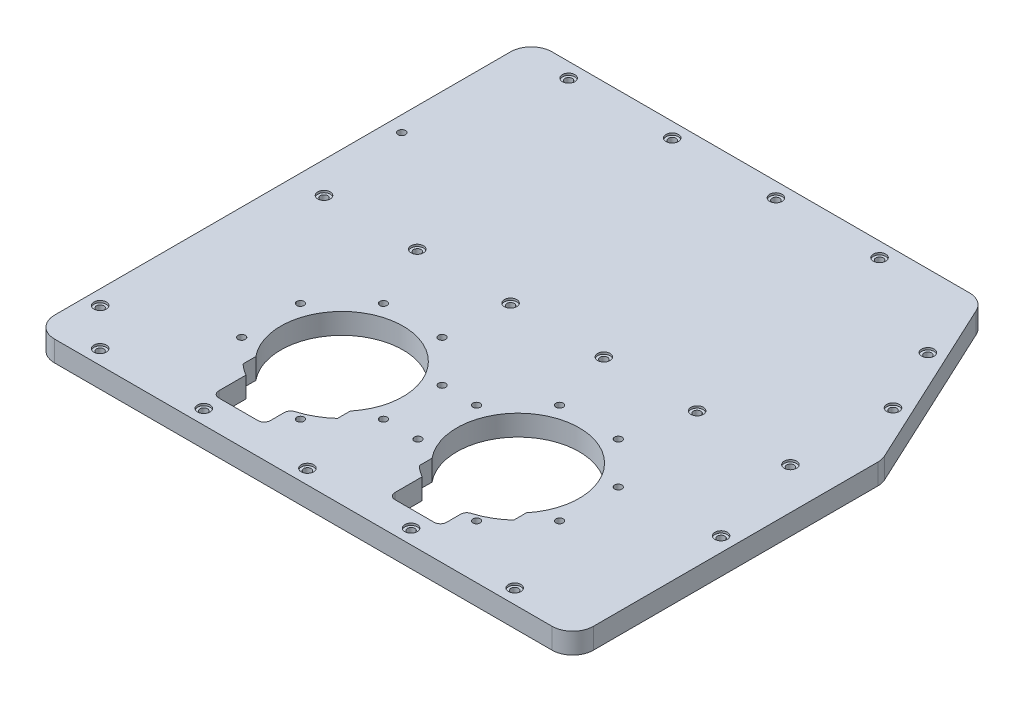
from build123d import *

# Parameters (mm, degrees)
EXTRUDE_1_DEPTH     = 10
SKETCH_2_R          = 1.75
CUT_EXTRUDE_1_DEPTH = 354.977400409
SKETCH_3_R          = 1.8
CUT_EXTRUDE_2_DEPTH = 354.977400409
CUT_EXTRUDE_3_REACH = 355.977
SKETCH_4_R          = 1.8
SKETCH_5_R          = 3
CUT_EXTRUDE_4_DEPTH = 1
SKETCH_8_R          = 4.907977916
SKETCH_8_R_2        = 2.263946164
EXTRUDE_3_DEPTH     = 2
CUT_EXTRUDE_5_REACH = 356.04
SKETCH_9_R          = 1.8
SKETCH_10_R         = 3
CUT_EXTRUDE_6_DEPTH = 1


with BuildPart() as part:
    # 草图1 → 凸台-拉伸1 (new body)
    with BuildSketch(Plane(origin=(0, 0, 0), x_dir=(1, 0, 0), z_dir=(0, 1, 0))):
        with BuildLine():
            Line((10, 0), (250, 0))
            ThreePointArc((250, 0), (257.071067812, 2.928932188), (260, 10))
            Line((260, 10), (260, 147.15227467))
            ThreePointArc((260, 147.15227467), (259.762960071, 149.316670809), (259.06307787, 151.378457287))
            Line((259.06307787, 151.378457287), (220.430549088, 234.226182617))
            ThreePointArc((220.430549088, 234.226182617), (216.740467301, 238.433914458), (211.367471218, 240))
            Line((211.367471218, 240), (10, 240))
            ThreePointArc((10, 240), (2.928932188, 237.071067812), (0, 230))
            Line((0, 230), (0, 10))
            ThreePointArc((0, 10), (2.928932188, 2.928932188), (10, 0))
        make_face()
    extrude(amount=EXTRUDE_1_DEPTH)

    # 草图2 → 切除-拉伸1 (cut, through all)
    with BuildSketch(Plane(origin=(0, 10, 0), x_dir=(1, 0, 0), z_dir=(0, 1, 0))):
        with BuildLine():
            ThreePointArc((98.278969632, 27.656873897), (96.730761312, 26.574772268), (96.136112489, 24.781929354))
            Line((96.136112489, 24.781929354), (96.136112489, 18))
            ThreePointArc((96.136112489, 18), (95.257432832, 15.878679656), (93.136112489, 15))
            Line((93.136112489, 15), (88.636112489, 15))
            Line((88.636112489, 15), (74.226112489, 15))
            ThreePointArc((74.226112489, 15), (72.104792145, 15.878679656), (71.226112489, 18))
            Line((71.226112489, 18), (71.226112489, 31.087123976))
            ThreePointArc((71.226112489, 31.087123976), (68.439256555, 32.960223552), (65.852320225, 35.100977729))
            Line((65.852320225, 35.100977729), (65.852320225, 41.261034979))
            ThreePointArc((65.852320225, 41.261034979), (88.636112489, 89.5), (111.419904753, 41.261034979))
            Line((111.419904753, 41.261034979), (111.419904753, 35.100977729))
            ThreePointArc((111.419904753, 35.100977729), (105.271182925, 30.634426081), (98.278969632, 27.656873897))
        make_face()
        with Locations(Location((74.476825491, 94.183542703, 0), (0, 0, 270))):
            Circle(SKETCH_2_R)
        with Locations(Location((102.795399486, 94.183542703, 0), (0, 0, 270))):
            Circle(SKETCH_2_R)
        with Locations(Location((122.819655192, 45.840713002, 0), (0, 0, 270))):
            Circle(SKETCH_2_R)
        with Locations(Location((102.795399486, 25.816457297, 0), (0, 0, 270))):
            Circle(SKETCH_2_R)
        with Locations(Location((54.452569786, 45.840713002, 0), (0, 0, 270))):
            Circle(SKETCH_2_R)
        with Locations(Location((54.452569786, 74.159286998, 0), (0, 0, 270))):
            Circle(SKETCH_2_R)
        with BuildLine():
            ThreePointArc((183.278969632, 27.656873897), (181.730761312, 26.574772268), (181.136112489, 24.781929354))
            Line((181.136112489, 24.781929354), (181.136112489, 18))
            ThreePointArc((181.136112489, 18), (180.257432832, 15.878679656), (178.136112489, 15))
            Line((178.136112489, 15), (173.636112489, 15))
            Line((173.636112489, 15), (159.226112489, 15))
            ThreePointArc((159.226112489, 15), (157.104792145, 15.878679656), (156.226112489, 18))
            Line((156.226112489, 18), (156.226112489, 31.087123976))
            ThreePointArc((156.226112489, 31.087123976), (153.439256555, 32.960223552), (150.852320225, 35.100977729))
            Line((150.852320225, 35.100977729), (150.852320225, 41.261034979))
            ThreePointArc((150.852320225, 41.261034979), (173.636112489, 89.5), (196.419904753, 41.261034979))
            Line((196.419904753, 41.261034979), (196.419904753, 35.100977729))
            ThreePointArc((196.419904753, 35.100977729), (190.271182925, 30.634426081), (183.278969632, 27.656873897))
        make_face()
        with Locations(Location((207.819655192, 45.840713002, 0), (0, 0, 270))):
            Circle(SKETCH_2_R)
        with Locations(Location((187.795399486, 25.816457297, 0), (0, 0, 270))):
            Circle(SKETCH_2_R)
        with Locations(Location((122.819655192, 74.159286998, 0), (0, 0, 270))):
            Circle(SKETCH_2_R)
        with Locations(Location((139.452569786, 45.840713002, 0), (0, 0, 270))):
            Circle(SKETCH_2_R)
        with Locations(Location((139.452569786, 74.159286998, 0), (0, 0, 270))):
            Circle(SKETCH_2_R)
        with Locations(Location((159.476825491, 94.183542703, 0), (0, 0, 270))):
            Circle(SKETCH_2_R)
        with Locations(Location((187.795399486, 94.183542703, 0), (0, 0, 270))):
            Circle(SKETCH_2_R)
        with Locations(Location((207.819655192, 74.159286998, 0), (0, 0, 270))):
            Circle(SKETCH_2_R)
    extrude(amount=-CUT_EXTRUDE_1_DEPTH, mode=Mode.SUBTRACT)

    # 草图3 → 切除-拉伸2 (cut, through all)
    with BuildSketch(Plane(origin=(0, 10, 0), x_dir=(1, 0, 0), z_dir=(0, 1, 0))):
        with Locations(Location((25, 7, 0), (0, 0, 270))):
            Circle(SKETCH_3_R)
        with Locations(Location((75, 7, 0), (0, 0, 270))):
            Circle(SKETCH_3_R)
        with Locations(Location((125, 7, 0), (0, 0, 270))):
            Circle(SKETCH_3_R)
        with Locations(Location((175, 7, 0), (0, 0, 270))):
            Circle(SKETCH_3_R)
        with Locations(Location((225, 7, 0), (0, 0, 270))):
            Circle(SKETCH_3_R)
        with Locations(Location((25, 233, 0), (0, 0, 270))):
            Circle(SKETCH_3_R)
        with Locations(Location((75, 233, 0), (0, 0, 270))):
            Circle(SKETCH_3_R)
        with Locations(Location((125, 233, 0), (0, 0, 270))):
            Circle(SKETCH_3_R)
        with Locations(Location((175, 233, 0), (0, 0, 270))):
            Circle(SKETCH_3_R)
        with Locations(Location((253, 78.576137335, 0), (0, 0, 270))):
            Circle(SKETCH_3_R)
        with Locations(Location((7, 25, 0), (0, 0, 270))):
            Circle(SKETCH_3_R)
        with Locations(Location((226.335296429, 205, 0), (0, 0, 270))):
            Circle(SKETCH_3_R)
        with Locations(Location((241.038259994, 173.469392883, 0), (0, 0, 270))):
            Circle(SKETCH_3_R)
    extrude(amount=-CUT_EXTRUDE_2_DEPTH, mode=Mode.SUBTRACT)

    # 草图4 → 切除-拉伸3 (cut, up to next)
    with BuildSketch(Plane(origin=(0, 10, 0), x_dir=(1, 0, 0), z_dir=(0, 1, 0)), mode=Mode.PRIVATE) as cut_extrude_3_sk1:
        with Locations(Location((15, 125, 0), (0, 0, 270))):
            Circle(SKETCH_4_R)
    cut_extrude_3_tool1 = extrude(cut_extrude_3_sk1.sketch, amount=-CUT_EXTRUDE_3_REACH, mode=Mode.PRIVATE) & part.part
    # 草图4 → 切除-拉伸3 (cut, up to next)
    with BuildSketch(Plane(origin=(0, 10, 0), x_dir=(1, 0, 0), z_dir=(0, 1, 0)), mode=Mode.PRIVATE) as cut_extrude_3_sk2:
        with Locations(Location((60, 125, 0), (0, 0, 270))):
            Circle(SKETCH_4_R)
    cut_extrude_3_tool2 = extrude(cut_extrude_3_sk2.sketch, amount=-CUT_EXTRUDE_3_REACH, mode=Mode.PRIVATE) & part.part
    # 草图4 → 切除-拉伸3 (cut, up to next)
    with BuildSketch(Plane(origin=(0, 10, 0), x_dir=(1, 0, 0), z_dir=(0, 1, 0)), mode=Mode.PRIVATE) as cut_extrude_3_sk3:
        with Locations(Location((105, 125, 0), (0, 0, 270))):
            Circle(SKETCH_4_R)
    cut_extrude_3_tool3 = extrude(cut_extrude_3_sk3.sketch, amount=-CUT_EXTRUDE_3_REACH, mode=Mode.PRIVATE) & part.part
    # 草图4 → 切除-拉伸3 (cut, up to next)
    with BuildSketch(Plane(origin=(0, 10, 0), x_dir=(1, 0, 0), z_dir=(0, 1, 0)), mode=Mode.PRIVATE) as cut_extrude_3_sk4:
        with Locations(Location((150, 125, 0), (0, 0, 270))):
            Circle(SKETCH_4_R)
    cut_extrude_3_tool4 = extrude(cut_extrude_3_sk4.sketch, amount=-CUT_EXTRUDE_3_REACH, mode=Mode.PRIVATE) & part.part
    # 草图4 → 切除-拉伸3 (cut, up to next)
    with BuildSketch(Plane(origin=(0, 10, 0), x_dir=(1, 0, 0), z_dir=(0, 1, 0)), mode=Mode.PRIVATE) as cut_extrude_3_sk5:
        with Locations(Location((195, 125, 0), (0, 0, 270))):
            Circle(SKETCH_4_R)
    cut_extrude_3_tool5 = extrude(cut_extrude_3_sk5.sketch, amount=-CUT_EXTRUDE_3_REACH, mode=Mode.PRIVATE) & part.part
    # 草图4 → 切除-拉伸3 (cut, up to next)
    with BuildSketch(Plane(origin=(0, 10, 0), x_dir=(1, 0, 0), z_dir=(0, 1, 0)), mode=Mode.PRIVATE) as cut_extrude_3_sk6:
        with Locations(Location((240, 125, 0), (0, 0, 270))):
            Circle(SKETCH_4_R)
    cut_extrude_3_tool6 = extrude(cut_extrude_3_sk6.sketch, amount=-CUT_EXTRUDE_3_REACH, mode=Mode.PRIVATE) & part.part
    add(cut_extrude_3_tool1.solids().sort_by_distance((15, 10, -125))[0], mode=Mode.SUBTRACT)
    add(cut_extrude_3_tool2.solids().sort_by_distance((60, 10, -125))[0], mode=Mode.SUBTRACT)
    add(cut_extrude_3_tool3.solids().sort_by_distance((105, 10, -125))[0], mode=Mode.SUBTRACT)
    add(cut_extrude_3_tool4.solids().sort_by_distance((150, 10, -125))[0], mode=Mode.SUBTRACT)
    add(cut_extrude_3_tool5.solids().sort_by_distance((195, 10, -125))[0], mode=Mode.SUBTRACT)
    add(cut_extrude_3_tool6.solids().sort_by_distance((240, 10, -125))[0], mode=Mode.SUBTRACT)

    # 草图5 → 切除-拉伸4 (cut)
    with BuildSketch(Plane.XZ):
        with Locations(Location((25, -7, 0), (0, 0, 270))):
            Circle(SKETCH_5_R)
        with Locations(Location((75, -7, 0), (0, 0, 270))):
            Circle(SKETCH_5_R)
        with Locations(Location((125, -7, 0), (0, 0, 270))):
            Circle(SKETCH_5_R)
        with Locations(Location((175, -7, 0), (0, 0, 270))):
            Circle(SKETCH_5_R)
        with Locations(Location((225, -7, 0), (0, 0, 270))):
            Circle(SKETCH_5_R)
        with Locations(Location((15, -125, 0), (0, 0, 270))):
            Circle(SKETCH_5_R)
        with Locations(Location((60, -125, 0), (0, 0, 270))):
            Circle(SKETCH_5_R)
        with Locations(Location((150, -125, 0), (0, 0, 270))):
            Circle(SKETCH_5_R)
        with Locations(Location((105, -125, 0), (0, 0, 270))):
            Circle(SKETCH_5_R)
        with Locations(Location((240, -125, 0), (0, 0, 270))):
            Circle(SKETCH_5_R)
        with Locations(Location((195, -125, 0), (0, 0, 270))):
            Circle(SKETCH_5_R)
        with Locations(Location((25, -233, 0), (0, 0, 270))):
            Circle(SKETCH_5_R)
        with Locations(Location((75, -233, 0), (0, 0, 270))):
            Circle(SKETCH_5_R)
        with Locations(Location((125, -233, 0), (0, 0, 270))):
            Circle(SKETCH_5_R)
        with Locations(Location((175, -233, 0), (0, 0, 270))):
            Circle(SKETCH_5_R)
        with Locations(Location((226.335296429, -205, 0), (0, 0, 270))):
            Circle(SKETCH_5_R)
        with Locations(Location((241.038259994, -173.469392883, 0), (0, 0, 270))):
            Circle(SKETCH_5_R)
        with Locations(Location((253, -78.576137335, 0), (0, 0, 270))):
            Circle(SKETCH_5_R)
        with Locations(Location((7, -25, 0), (0, 0, 270))):
            Circle(SKETCH_5_R)
    cut_extrude_4 = extrude(amount=-CUT_EXTRUDE_4_DEPTH, mode=Mode.SUBTRACT)

    # 镜向1: 切除-拉伸4 across plane
    add(cut_extrude_4.mirror(Plane(origin=(0, 5, 0), x_dir=(0, 0, 1), z_dir=(0, -1, 0))), mode=Mode.SUBTRACT)

    # 草图8 → 凸台-拉伸3 (add)
    # profile 1 of 9: a face of its own
    with BuildSketch(Plane.XZ):
        with Locations(Location((158.544951124, -177.365322878, 0), (0, 0, 270))):
            Circle(SKETCH_8_R)
        with Locations(Location((158.544951124, -177.365322878, 0), (0, 0, 270))):
            Circle(SKETCH_8_R_2, mode=Mode.SUBTRACT)
    # profile 2 of 9: a face of its own
    with BuildSketch(Plane.XZ):
        with Locations(Location((173.660573493, -195.305752058, 0), (0, 0, 270))):
            Circle(SKETCH_8_R)
        with Locations(Location((173.660573493, -195.305752058, 0), (0, 0, 270))):
            Circle(SKETCH_8_R_2, mode=Mode.SUBTRACT)
    # profile 3 of 9: a face of its own
    with BuildSketch(Plane.XZ):
        Polygon((22.073938374, -172.097822024), (15.231344223, -200.682207265), (22.073938374, -200.682207265), (24.685267184, -189.773591751), (38.187143954, -189.773591751), (39.662170874, -183.611785747), (26.054433583, -183.611785747), (28.810672003, -172.097822024), align=None)
    # profile 4 of 9: a face of its own
    with BuildSketch(Plane.XZ):
        Polygon((44.809009261, -172.097822024), (38.187143954, -200.682207265), (44.809009261, -200.682207265), (51.430874568, -172.097822024), align=None)
    # profile 5 of 9: a face of its own
    with BuildSketch(Plane.XZ):
        with BuildLine():
            Line((53.748527425, -194.391435224), (48.119941914, -200.682207265))
            Line((48.119941914, -200.682207265), (71.627563754, -200.682207265))
            add(Edge.make_bspline(
                [(73.780158647, -183.246086784), (75.088103818, -183.395423758), (76.759745619, -184.457891186), (79.163494419, -186.207419575), (80.010768681, -188.654391183), (80.521360508, -191.374485794), (80.151623322, -194.047174877), (78.880559878, -196.769522685), (76.840381971, -198.518044272), (74.359109659, -200.019572646), (72.636291598, -200.360258134), (71.627563754, -200.682207265)],
                knots=[0, 0, 0, 0, 0.151325932, 0.234201761, 0.344779966, 0.445070875, 0.563167259, 0.657544806, 0.795637414, 0.873867589, 1, 1, 1, 1], degree=3))
            Line((73.780158647, -183.246086784), (60.607841376, -183.246086784))
            add(Edge.make_bspline(
                [(61.651193239, -178.420584418), (60.765401929, -178.531115754), (59.223308687, -180.081147684), (58.798414256, -182.644004283), (60.607841376, -183.246086784)],
                knots=[0, 0, 0, 0, 0.381797623, 1, 1, 1, 1], degree=3))
            Line((61.651193239, -178.420584418), (86.778583941, -178.420584418))
            Line((86.778583941, -178.420584418), (92.169235234, -198.635526764))
            add(Edge.make_bspline(
                [(92.169235234, -198.635526764), (92.888270553, -199.558423552), (94.369891723, -200.676985301), (97.770511283, -201.306323229), (99.892467694, -200.052941372), (101.065133652, -199.11230522)],
                knots=[0, 0, 0, 0, 0.346245125, 0.532187603, 1, 1, 1, 1], degree=3))
            Line((101.065133652, -199.11230522), (122.960969743, -172.097822024))
            Line((122.960969743, -172.097822024), (114.791265803, -172.097822024))
            Line((114.791265803, -172.097822024), (97.921357665, -193.461225354))
            Line((97.921357665, -193.461225354), (95.21580636, -183.611785747))
            Line((95.21580636, -183.611785747), (102.006209636, -183.611785747))
            Line((102.006209636, -183.611785747), (106.815911828, -177.520963734))
            Line((106.815911828, -177.520963734), (93.518205541, -177.520963734))
            Line((93.518205541, -177.520963734), (92.028517933, -172.097822024))
            Line((92.028517933, -172.097822024), (62.546887283, -172.097822024))
            add(Edge.make_bspline(
                [(62.546887283, -172.097822024), (60.854790531, -172.078260419), (58.321003199, -172.860146277), (55.583618593, -174.978353544), (53.956265899, -177.184924665), (53.049590925, -179.733453335), (52.766173388, -182.432114561), (53.084546334, -185.09950041), (54.993235768, -188.054919432), (57.359256098, -189.172353937), (58.82544861, -189.773591751)],
                knots=[0, 0, 0, 0, 0.19448887, 0.297455884, 0.396977744, 0.508302196, 0.606621836, 0.710401625, 0.813271337, 1, 1, 1, 1], degree=3))
            Line((58.82544861, -189.773591751), (72.345549836, -189.773591751))
            add(Edge.make_bspline(
                [(72.345549836, -189.773591751), (73.46965008, -189.705168737), (73.8978609, -191.281831866), (73.73776215, -193.791818442), (72.08439778, -193.970429011), (71.627563754, -194.391435224)],
                knots=[0, 0, 0, 0, 0.391663817, 0.698151356, 1, 1, 1, 1], degree=3))
            Line((71.627563754, -194.391435224), (53.748527425, -194.391435224))
        make_face()
    # profile 6 of 9: a face of its own
    with BuildSketch(Plane.XZ):
        with BuildLine():
            Line((125.616342242, -172.097822024), (120.806000946, -178.420584418))
            Line((120.806000946, -178.420584418), (139.533283855, -178.420584418))
            add(Edge.make_bspline(
                [(139.533283855, -178.420584418), (142.130616034, -179.25287), (141.259131496, -182.204744009)],
                knots=[0, 0, 0, 1, 1, 1], degree=2))
            Line((141.259131496, -182.204744009), (136.868946192, -200.682207265))
            Line((136.868946192, -200.682207265), (143.467604144, -200.682207265))
            Line((143.467604144, -200.682207265), (147.974316097, -181.714305287))
            add(Edge.make_bspline(
                [(140.524213329, -172.097822024), (141.582125241, -172.235603988), (143.088702623, -172.926269182), (144.749141608, -173.982656573), (145.908558135, -174.777621431), (146.392854672, -175.838553911), (147.208451771, -176.458531324), (147.379145931, -177.285298746), (147.757265075, -178.141135784), (148.121187161, -179.672607542), (147.902035156, -180.92906007), (147.974316097, -181.714305287)],
                knots=[0, 0, 0, 0, 0.234104122, 0.362839069, 0.441119268, 0.539991871, 0.615492284, 0.655852222, 0.722699044, 0.824656068, 1, 1, 1, 1], degree=3))
            Line((140.524213329, -172.097822024), (125.616342242, -172.097822024))
        make_face()
    # profile 7 of 9: a face of its own
    with BuildSketch(Plane.XZ):
        with BuildLine():
            Line((161.996464945, -172.097822024), (186.115361718, -172.097822024))
            Line((186.115361718, -172.097822024), (181.445532768, -178.420584418))
            Line((181.445532768, -178.420584418), (165.126789845, -178.420584418))
            add(Edge.make_bspline(
                [(161.996464945, -172.097822024), (162.711917683, -172.413910698), (164.07469848, -173.128766473), (165.043190806, -175.578249748), (165.236489506, -177.286697785), (165.126789845, -178.420584418)],
                knots=[0, 0, 0, 0, 0.319160742, 0.557978619, 1, 1, 1, 1], degree=3))
        make_face()
    # profile 8 of 9: a face of its own
    with BuildSketch(Plane.XZ):
        with BuildLine():
            Line((152.579698021, -194.391435224), (147.201016501, -200.682207265))
            Line((147.201016501, -200.682207265), (170.436920669, -200.682207265))
            add(Edge.make_bspline(
                [(166.922848742, -194.391435224), (166.354612172, -195.594154108), (167.097743622, -196.757713959), (167.49965679, -198.317534631), (168.043584272, -198.993598191), (168.713481416, -200.101093764), (169.868436813, -200.383736725), (170.436920669, -200.682207265)],
                knots=[0, 0, 0, 0, 0.407752289, 0.516739301, 0.604038017, 0.73573215, 1, 1, 1, 1], degree=3))
            Line((166.922848742, -194.391435224), (152.579698021, -194.391435224))
        make_face()
    # profile 9 of 9: a face of its own
    with BuildSketch(Plane.XZ):
        with BuildLine():
            Line((175.354815826, -189.393630095), (159.147930299, -189.393630095))
            add(Edge.make_bspline(
                [(152.24064934, -178.006960744), (151.756516215, -179.286821423), (151.050347278, -181.667421041), (152.295747244, -184.475698498), (152.927685882, -186.731310873), (155.560688134, -188.427865401), (157.361246182, -189.647692005), (159.147930299, -189.393630095)],
                knots=[0, 0, 0, 0, 0.272095417, 0.424693629, 0.579586055, 0.697267501, 1, 1, 1, 1], degree=3))
            add(Edge.make_bspline(
                [(160.210588908, -183.246086784), (159.003851072, -183.315935364), (157.03110272, -183.837809443), (154.600789986, -182.742780426), (152.82282403, -180.962215729), (152.274092142, -179.139530743), (152.24064934, -178.006960744)],
                knots=[0, 0, 0, 0, 0.335355058, 0.510172496, 0.694454761, 1, 1, 1, 1], degree=3))
            Line((160.210588908, -183.246086784), (174.363269473, -183.611785747))
            add(Edge.make_bspline(
                [(174.363269473, -183.611785747), (175.570389495, -183.558998636), (177.398272704, -184.55882365), (179.940299536, -186.730125313), (181.52555342, -190.65499704), (180.993171607, -193.959638714), (180.111947293, -195.622791622)],
                knots=[0, 0, 0, 0, 0.224398025, 0.388730173, 0.637988574, 1, 1, 1, 1], degree=3))
            add(Edge.make_bspline(
                [(175.354815826, -189.393630095), (176.24630786, -189.655653753), (177.70235436, -190.066055249), (179.71766294, -192.195117194), (180.205671196, -194.186249), (180.111947293, -195.622791622)],
                knots=[0, 0, 0, 0, 0.330460725, 0.500355771, 1, 1, 1, 1], degree=3))
        make_face()
    extrude(amount=EXTRUDE_3_DEPTH)

    # 草图9 → 切除-拉伸5 (cut, up to next)
    with BuildSketch(Plane(origin=(0, 10, 0), x_dir=(1, 0, 0), z_dir=(0, 1, 0)), mode=Mode.PRIVATE) as cut_extrude_5_sk1:
        with Locations(Location((7.5, 170, 0), (0, 0, 270))):
            Circle(SKETCH_9_R)
    cut_extrude_5_tool1 = extrude(cut_extrude_5_sk1.sketch, amount=-CUT_EXTRUDE_5_REACH, mode=Mode.PRIVATE) & part.part
    add(cut_extrude_5_tool1.solids().sort_by_distance((7.5, 10, -170))[0], mode=Mode.SUBTRACT)

    # 草图10 → 切除-拉伸6 (cut)
    with BuildSketch(Plane.XZ):
        with Locations(Location((7.5, -170, 0), (0, 0, 270))):
            Circle(SKETCH_10_R)
    extrude(amount=-CUT_EXTRUDE_6_DEPTH, mode=Mode.SUBTRACT)


solid = part.part
